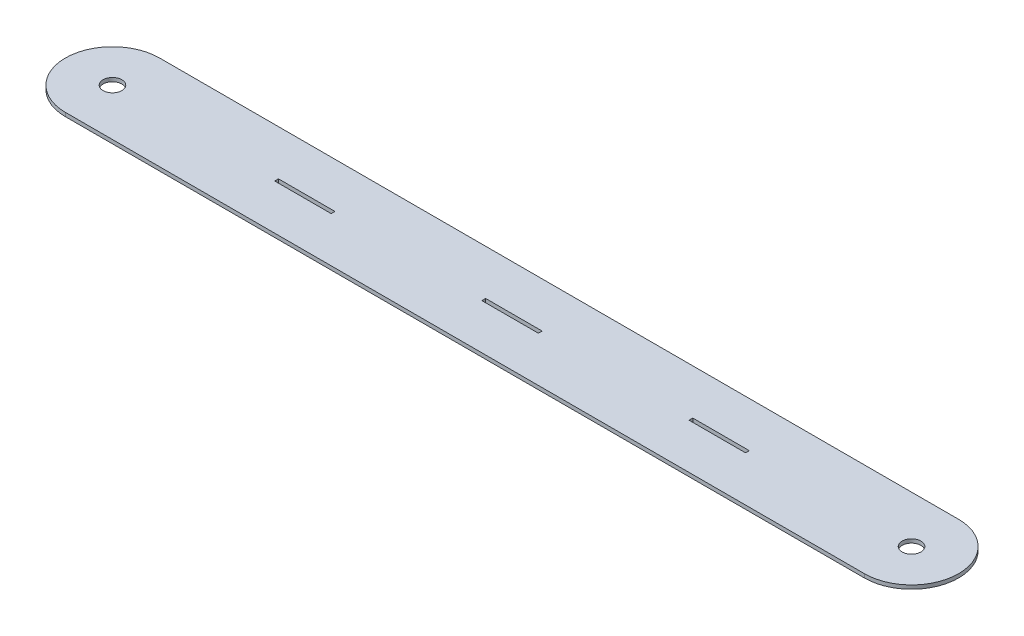
from build123d import *

# Parameters (mm, degrees)
SKETCH1_R           = 2.5
SKETCH1_W           = 15
SKETCH1_H           = 1
BOSS_EXTRUDE1_DEPTH = 1


with BuildPart() as part:
    # Sketch1 → Boss-Extrude1 (new body)
    with BuildSketch(Plane(origin=(0, 0, 0), x_dir=(1, 0, 0), z_dir=(0, 1, 0))):
        with BuildLine():
            Line((0, 12.5), (212.132034356, 12.5))
            ThreePointArc((212.132034356, 12.5), (224.632034356, 0), (212.132034356, -12.5))
            Line((212.132034356, -12.5), (0, -12.5))
            ThreePointArc((0, -12.5), (-12.5, 0), (0, 12.5))
        make_face()
        with Locations(Location((0, 0, 0), (0, 0, 270))):
            Circle(SKETCH1_R, mode=Mode.SUBTRACT)
        with Locations(Location((212.132034356, 0, 0), (0, 0, 270))):
            Circle(SKETCH1_R, mode=Mode.SUBTRACT)
        with Locations((51.066017178, 0)):
            Rectangle(SKETCH1_W, SKETCH1_H, mode=Mode.SUBTRACT)
        with Locations((106.066017178, 0)):
            Rectangle(SKETCH1_W, SKETCH1_H, mode=Mode.SUBTRACT)
        with Locations((161.066017178, 0)):
            Rectangle(SKETCH1_W, SKETCH1_H, mode=Mode.SUBTRACT)
    extrude(amount=BOSS_EXTRUDE1_DEPTH)


solid = part.part
